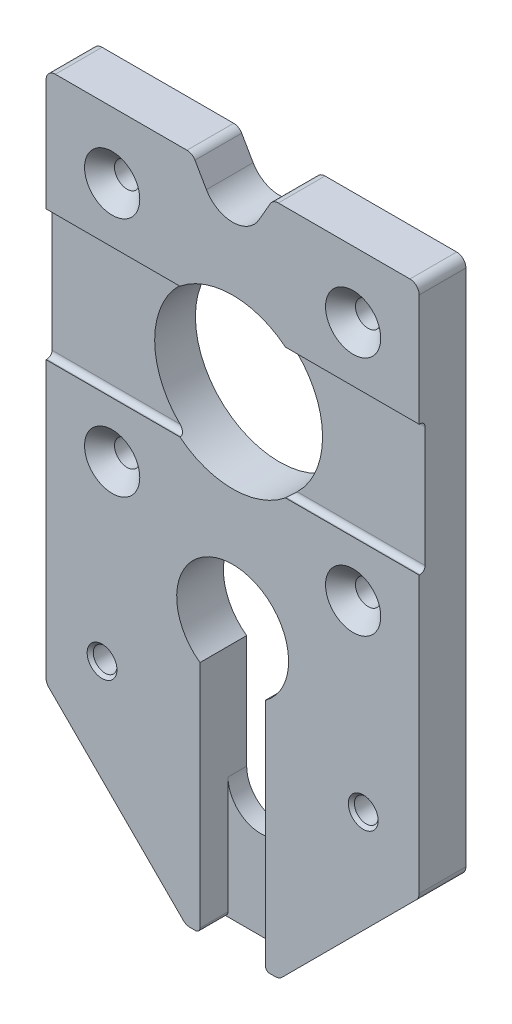
from build123d import *

# Parameters (mm, degrees)
SKETCH1_R                                       = 14.2875
BOSS_EXTRUDE1_DEPTH                             = 7.9502
CUT_EXTRUDE1_DEPTH                              = 4.7752
CSK_FOR_M4_FLAT_HEAD_MACHINE_SCREW1_D           = 4.3
CSK_FOR_M4_FLAT_HEAD_MACHINE_SCREW1_CSINK_D     = 9.4
CSK_FOR_M4_FLAT_HEAD_MACHINE_SCREW1_CSINK_ANGLE = 90
CIRPATTERN1_COUNT                               = 4
F_10_32_TAPPED_HOLE1_AT_2_COUNT                 = 2
F_10_32_TAPPED_HOLE1_AT_2_PITCH                 = 44.45
CUT_EXTRUDE2_DEPTH                              = 89.801861918
FILLET1_R                                       = 1.5748
FILLET2_R                                       = 0.762
SKETCH12_W                                      = 73.210736231
SKETCH12_H                                      = 22.225
CUT_EXTRUDE3_DEPTH                              = 1.016
FILLET3_R                                       = 0.889


with BuildPart() as part:
    # Sketch1 → Boss-Extrude1 (new body)
    with BuildSketch(Plane.XY):
        Polygon((-31.75, 31.75), (31.75, 31.75), (31.75, -58.7248), (7.9248, -82.55), (-7.9248, -82.55), (-31.75, -58.7248), align=None)
        Circle(SKETCH1_R, mode=Mode.SUBTRACT)
        with BuildLine():
            Line((5.5626, -42.656953585), (5.5626, -61.9125))
            ThreePointArc((5.5626, -61.9125), (0, -67.4751), (-5.5626, -61.9125))
            Line((-5.5626, -61.9125), (-5.5626, -42.656953585))
            ThreePointArc((-5.5626, -42.656953585), (0, -25.4), (5.5626, -42.656953585))
        make_face(mode=Mode.SUBTRACT)
    extrude(amount=-BOSS_EXTRUDE1_DEPTH)

    # Sketch4 → Cut-Extrude1 (cut)
    with BuildSketch(Plane.XY):
        with BuildLine():
            Line((5.5626, -111.125), (5.5626, -34.925))
            ThreePointArc((5.5626, -34.925), (0, -29.3624), (-5.5626, -34.925))
            Line((-5.5626, -34.925), (-5.5626, -111.125))
            Line((-5.5626, -111.125), (5.5626, -111.125))
        make_face()
    extrude(amount=-CUT_EXTRUDE1_DEPTH, mode=Mode.SUBTRACT)

    # CSK for M4 Flat Head Machine Screw1 (through all)
    with Locations(Plane.XY):
        with Locations((20.506096654, 20.506096654)):
            csk_for_m4_flat_head_machine_screw1 = CounterSinkHole(CSK_FOR_M4_FLAT_HEAD_MACHINE_SCREW1_D / 2, CSK_FOR_M4_FLAT_HEAD_MACHINE_SCREW1_CSINK_D / 2, counter_sink_angle=CSK_FOR_M4_FLAT_HEAD_MACHINE_SCREW1_CSINK_ANGLE)

    # CirPattern1: CSK for M4 Flat Head Machine Screw1 ×4 about axis
    cirpattern1_axis = Axis((0, 0, 0), (0, 0, 1))
    for i in range(1, CIRPATTERN1_COUNT):
        add(csk_for_m4_flat_head_machine_screw1.rotate(cirpattern1_axis, i * 360 / CIRPATTERN1_COUNT), mode=Mode.SUBTRACT)

    # Sketch7 → #10-32 Tapped Hole1 (revolve, cut)
    with BuildSketch(Plane(origin=(22.225, -50.8, 0), x_dir=(0, -1, 0), z_dir=(1, 0, 0))):
        Polygon((0, 0), (0, 7.9502), (2.54, 7.9502), (2.0193, 7.4295), (2.0193, 0.5207), (2.54, 0), align=None)
    f_10_32_tapped_hole1 = revolve(axis=Axis((22.225, -50.8, 6.35), (0, 0, -1)), mode=Mode.SUBTRACT)

    # #10-32 Tapped Hole1 at 2: #10-32 Tapped Hole1 ×2
    with Locations(*[(-i * F_10_32_TAPPED_HOLE1_AT_2_PITCH, 0, 0) for i in range(1, F_10_32_TAPPED_HOLE1_AT_2_COUNT)]):
        add(f_10_32_tapped_hole1, mode=Mode.SUBTRACT)

    # Sketch8 → Cut-Extrude2 (cut, through all)
    with BuildSketch(Plane.XY):
        with BuildLine():
            Line((-4.465400187, 27.5971), (-13.062271505, 42.487317908))
            Line((-13.062271505, 42.487317908), (13.062271505, 42.487317908))
            Line((13.062271505, 42.487317908), (4.465400187, 27.5971))
            ThreePointArc((4.465400187, 27.5971), (0, 25.019), (-4.465400187, 27.5971))
        make_face()
    extrude(amount=-CUT_EXTRUDE2_DEPTH, mode=Mode.SUBTRACT)

    # Fillet1
    fillet1_edges = [part.edges().sort_by_distance(p)[0] for p in [
        (-31.75, 31.75, -3.9751),
        (31.75, 31.75, -3.9751),
        (31.75, -58.7248, -3.9751),
        (7.9248, -82.55, -3.9751),
        (-7.9248, -82.55, -3.9751),
        (-31.75, -58.7248, -3.9751),
        (-6.86307812, 31.75, -3.9751),
        (6.86307812, 31.75, -3.9751),
    ]]
    fillet(fillet1_edges, radius=FILLET1_R)

    # Fillet2
    fillet2_edges = [part.edges().sort_by_distance(p)[0] for p in [
        (-5.5626, -82.55, -2.3876),
        (5.5626, -82.55, -2.3876),
    ]]
    fillet(fillet2_edges, radius=FILLET2_R)

    # Sketch12 → Cut-Extrude3 (cut)
    with BuildSketch(Plane.XY):
        with Locations((0.072940044, 0)):
            Rectangle(SKETCH12_W, SKETCH12_H)
    extrude(amount=-CUT_EXTRUDE3_DEPTH, mode=Mode.SUBTRACT)

    # Fillet3
    fillet3_edges = [part.edges().sort_by_distance(p)[0] for p in [
        (20.365128061, -11.1125, -1.016),
        (-20.365128061, -11.1125, -1.016),
        (-20.365128061, 11.1125, -1.016),
        (20.365128061, 11.1125, -1.016),
    ]]
    fillet(fillet3_edges, radius=FILLET3_R)


solid = part.part
